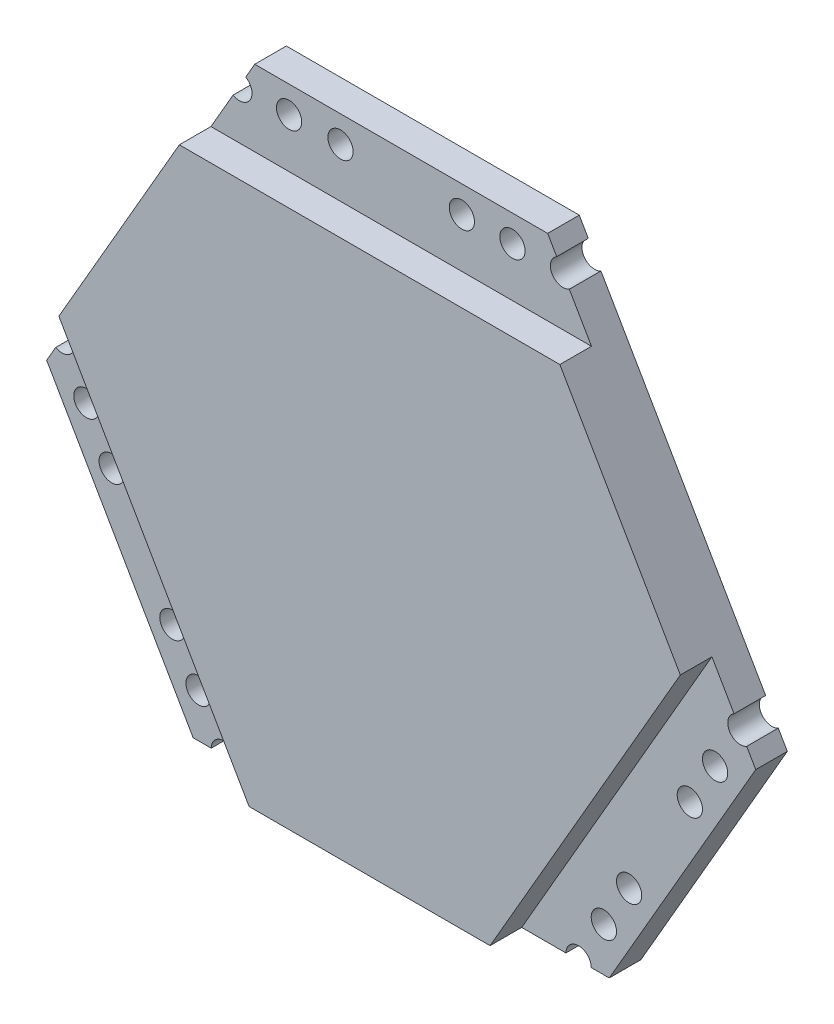
from build123d import *

# Parameters (mm, degrees)
EXTRUDE_4_DEPTH      = 10
SKETCH_4_W           = 60.2
SKETCH_4_H           = 12
CUT_EXTRUDE_2_DEPTH  = 5
CUT_EXTRUDE_9_DEPTH  = 125.764203881
CUT_EXTRUDE_12_DEPTH = 127.561979888
CUT_EXTRUDE_13_DEPTH = 124.620047186
CUT_EXTRUDE_15_DEPTH = 2


with BuildPart() as part:
    # 草圖1 → 填料-伸長4 (new body)
    with BuildSketch(Plane.XY):
        Polygon((49.802669845, 25.924393386), (-10.397330155, 25.924393386), (-29.457330155, -7.088495007), (0.642669845, -59.223224314), (38.762669845, -59.223224314), (68.862669845, -7.088495007), align=None)
        with BuildLine():
            Line((-0.037670798, 33.71862202), (-3.897330155, 33.71862202))
            ThreePointArc((-3.897330155, 33.71862202), (-4.897330155, 31.986571212), (-6.897330155, 31.986571212))
            Line((-6.897330155, 31.986571212), (-10.397330155, 25.924393386))
            Line((-10.397330155, 25.924393386), (49.802669845, 25.924393386))
            Line((49.802669845, 25.924393386), (46.302669845, 31.986571212))
            ThreePointArc((46.302669845, 31.986571212), (44.302669845, 31.986571212), (43.302669845, 33.71862202))
            Line((43.302669845, 33.71862202), (39.302669845, 33.71862202))
            ThreePointArc((39.302669845, 33.71862202), (37.302669845, 31.71862202), (35.302669845, 33.71862202))
            Line((35.302669845, 33.71862202), (31.302669845, 33.71862202))
            ThreePointArc((31.302669845, 33.71862202), (29.302669845, 31.71862202), (27.302669845, 33.71862202))
            Line((27.302669845, 33.71862202), (12.102669845, 33.71862202))
            ThreePointArc((12.102669845, 33.71862202), (10.102669845, 31.71862202), (8.102669845, 33.71862202))
            Line((8.102669845, 33.71862202), (3.962329202, 33.71862202))
            ThreePointArc((3.962329202, 33.71862202), (1.962329202, 31.71862202), (-0.037670798, 33.71862202))
        make_face()
        with BuildLine():
            ThreePointArc((-6.897330155, 31.986571212), (-6.897330155, 35.450672827), (-3.897330155, 33.71862202))
            Line((-3.897330155, 33.71862202), (-0.037670798, 33.71862202))
            ThreePointArc((-0.037670798, 33.71862202), (1.962329202, 35.71862202), (3.962329202, 33.71862202))
            Line((3.962329202, 33.71862202), (8.102669845, 33.71862202))
            ThreePointArc((8.102669845, 33.71862202), (10.102669845, 35.71862202), (12.102669845, 33.71862202))
            Line((12.102669845, 33.71862202), (27.302669845, 33.71862202))
            ThreePointArc((27.302669845, 33.71862202), (29.302669845, 35.71862202), (31.302669845, 33.71862202))
            Line((31.302669845, 33.71862202), (35.302669845, 33.71862202))
            ThreePointArc((35.302669845, 33.71862202), (37.302669845, 35.71862202), (39.302669845, 33.71862202))
            Line((39.302669845, 33.71862202), (43.302669845, 33.71862202))
            ThreePointArc((43.302669845, 33.71862202), (45.302669845, 35.71862202), (47.302669845, 33.71862202))
            ThreePointArc((47.302669845, 33.71862202), (47.034720652, 32.71862202), (46.302669845, 31.986571212))
            Line((46.302669845, 31.986571212), (49.802669845, 25.924393386))
            Line((49.802669845, 25.924393386), (49.802669845, 37.924393386))
            Line((49.802669845, 37.924393386), (-10.397330155, 37.924393386))
            Line((-10.397330155, 37.924393386), (-10.397330155, 25.924393386))
            Line((-10.397330155, 25.924393386), (-6.897330155, 31.986571212))
        make_face()
        with BuildLine():
            Line((-32.957330155, -13.150672833), (-29.457330155, -7.088495007))
            Line((-29.457330155, -7.088495007), (-39.849635001, -13.088495007))
            Line((-39.849635001, -13.088495007), (-9.749635001, -65.223224314))
            Line((-9.749635001, -65.223224314), (0.642669845, -59.223224314))
            Line((0.642669845, -59.223224314), (-6.357330155, -59.223224314))
            ThreePointArc((-6.357330155, -59.223224314), (-9.357330155, -60.955275122), (-9.357330155, -57.491173507))
            Line((-9.357330155, -57.491173507), (-11.357330155, -54.027071892))
            ThreePointArc((-11.357330155, -54.027071892), (-14.089380963, -53.295021084), (-13.357330155, -50.562970277))
            Line((-13.357330155, -50.562970277), (-15.394263476, -47.034898273))
            ThreePointArc((-15.394263476, -47.034898273), (-18.229721605, -46.366817854), (-17.390567155, -43.577198874))
            Line((-17.390567155, -43.577198874), (-24.994263476, -30.40721052))
            ThreePointArc((-24.994263476, -30.40721052), (-27.829721605, -29.739130101), (-26.990567155, -26.949511121))
            Line((-26.990567155, -26.949511121), (-28.994263476, -23.47900729))
            ThreePointArc((-28.994263476, -23.47900729), (-31.829721605, -22.810926871), (-30.990567155, -20.021307891))
            Line((-30.990567155, -20.021307891), (-32.957330155, -16.614774448))
            ThreePointArc((-32.957330155, -16.614774448), (-35.957330155, -14.882723641), (-32.957330155, -13.150672833))
        make_face()
        with BuildLine():
            Line((0.642669845, -59.223224314), (-29.457330155, -7.088495007))
            Line((-29.457330155, -7.088495007), (-32.957330155, -13.150672833))
            ThreePointArc((-32.957330155, -13.150672833), (-32.225279348, -13.882723641), (-31.957330155, -14.882723641))
            ThreePointArc((-31.957330155, -14.882723641), (-32.225279348, -15.882723641), (-32.957330155, -16.614774448))
            Line((-32.957330155, -16.614774448), (-30.990567155, -20.021307891))
            ThreePointArc((-30.990567155, -20.021307891), (-29.045480871, -20.110075214), (-28.097670798, -21.810926871))
            ThreePointArc((-28.097670798, -21.810926871), (-28.336021763, -22.75781265), (-28.994263476, -23.47900729))
            Line((-28.994263476, -23.47900729), (-26.990567155, -26.949511121))
            ThreePointArc((-26.990567155, -26.949511121), (-25.045480871, -27.038278445), (-24.097670798, -28.739130101))
            ThreePointArc((-24.097670798, -28.739130101), (-24.336021763, -29.68601588), (-24.994263476, -30.40721052))
            Line((-24.994263476, -30.40721052), (-17.390567155, -43.577198874))
            ThreePointArc((-17.390567155, -43.577198874), (-15.445480871, -43.665966197), (-14.497670798, -45.366817854))
            ThreePointArc((-14.497670798, -45.366817854), (-14.736021763, -46.313703633), (-15.394263476, -47.034898273))
            Line((-15.394263476, -47.034898273), (-13.357330155, -50.562970277))
            ThreePointArc((-13.357330155, -50.562970277), (-11.357330155, -50.562970277), (-10.357330155, -52.295021084))
            ThreePointArc((-10.357330155, -52.295021084), (-10.625279348, -53.295021084), (-11.357330155, -54.027071892))
            Line((-11.357330155, -54.027071892), (-9.357330155, -57.491173507))
            ThreePointArc((-9.357330155, -57.491173507), (-7.357330155, -57.491173507), (-6.357330155, -59.223224314))
            Line((-6.357330155, -59.223224314), (0.642669845, -59.223224314))
        make_face()
        with BuildLine():
            Line((79.25497469, -13.088495007), (68.862669845, -7.088495007))
            Line((68.862669845, -7.088495007), (72.362669845, -13.150672833))
            ThreePointArc((72.362669845, -13.150672833), (74.362669845, -13.150672833), (75.362669845, -14.882723641))
            ThreePointArc((75.362669845, -14.882723641), (74.362669845, -16.614774448), (72.362669845, -16.614774448))
            Line((72.362669845, -16.614774448), (70.362669845, -20.078876063))
            ThreePointArc((70.362669845, -20.078876063), (71.094720652, -20.810926871), (71.362669845, -21.810926871))
            ThreePointArc((71.362669845, -21.810926871), (70.362669845, -23.542977679), (68.362669845, -23.542977679))
            Line((68.362669845, -23.542977679), (66.362669845, -27.007079294))
            ThreePointArc((66.362669845, -27.007079294), (67.094720652, -27.739130101), (67.362669845, -28.739130101))
            ThreePointArc((67.362669845, -28.739130101), (66.362669845, -30.471180909), (64.362669845, -30.471180909))
            Line((64.362669845, -30.471180909), (56.762669845, -43.634767046))
            ThreePointArc((56.762669845, -43.634767046), (57.494720652, -44.366817854), (57.762669845, -45.366817854))
            ThreePointArc((57.762669845, -45.366817854), (56.762669845, -47.098868661), (54.762669845, -47.098868661))
            Line((54.762669845, -47.098868661), (52.762669845, -50.562970277))
            ThreePointArc((52.762669845, -50.562970277), (53.494720652, -51.295021084), (53.762669845, -52.295021084))
            ThreePointArc((53.762669845, -52.295021084), (52.762669845, -54.027071892), (50.762669845, -54.027071892))
            Line((50.762669845, -54.027071892), (48.762669845, -57.491173507))
            ThreePointArc((48.762669845, -57.491173507), (49.494720652, -58.223224314), (49.762669845, -59.223224314))
            ThreePointArc((49.762669845, -59.223224314), (47.762669845, -61.223224314), (45.762669845, -59.223224314))
            Line((45.762669845, -59.223224314), (38.762669845, -59.223224314))
            Line((38.762669845, -59.223224314), (49.15497469, -65.223224314))
            Line((49.15497469, -65.223224314), (79.25497469, -13.088495007))
        make_face()
        with BuildLine():
            Line((72.362669845, -13.150672833), (68.862669845, -7.088495007))
            Line((68.862669845, -7.088495007), (38.762669845, -59.223224314))
            Line((38.762669845, -59.223224314), (45.762669845, -59.223224314))
            ThreePointArc((45.762669845, -59.223224314), (46.762669845, -57.491173507), (48.762669845, -57.491173507))
            Line((48.762669845, -57.491173507), (50.762669845, -54.027071892))
            ThreePointArc((50.762669845, -54.027071892), (50.030619037, -51.295021084), (52.762669845, -50.562970277))
            Line((52.762669845, -50.562970277), (54.762669845, -47.098868661))
            ThreePointArc((54.762669845, -47.098868661), (54.030619037, -44.366817854), (56.762669845, -43.634767046))
            Line((56.762669845, -43.634767046), (64.362669845, -30.471180909))
            ThreePointArc((64.362669845, -30.471180909), (63.630619037, -27.739130101), (66.362669845, -27.007079294))
            Line((66.362669845, -27.007079294), (68.362669845, -23.542977679))
            ThreePointArc((68.362669845, -23.542977679), (67.630619037, -20.810926871), (70.362669845, -20.078876063))
            Line((70.362669845, -20.078876063), (72.362669845, -16.614774448))
            ThreePointArc((72.362669845, -16.614774448), (71.362669845, -14.882723641), (72.362669845, -13.150672833))
        make_face()
    extrude(amount=EXTRUDE_4_DEPTH)

    # 草圖4 → 除料-伸長2 (cut)
    with BuildSketch(Plane.XY.offset(10)):
        Polygon((38.762669845, -59.223224314), (49.15497469, -65.223224314), (79.264488572, -13.07201648), (68.872183727, -7.07201648), align=None)
        with Locations((19.702669845, 31.924393386)):
            Rectangle(SKETCH_4_W, SKETCH_4_H)
        Polygon((-29.457330155, -7.088495007), (-39.849635001, -13.088495007), (-9.472158735, -65.703827304), (0.92014611, -59.703827304), align=None)
    extrude(amount=-CUT_EXTRUDE_2_DEPTH, mode=Mode.SUBTRACT)

    # 草圖7 → 除料-伸長9 (cut, through all)
    with BuildSketch(Plane(origin=(-19.023589241, 10.983274369, 0), x_dir=(0, 0, 1), z_dir=(-0.8660254037844397, 0.499999999999998, 0))):
        Polygon((5, -20.867481828), (0, -20.867481828), (0, -53.816238545), (10, -53.816238545), (10, -20.867481828), align=None)
        Polygon((0, 46.26799966), (0, 17.252518172), (5, 17.252518172), (10, 17.252518172), (10, 46.26799966), align=None)
    extrude(amount=CUT_EXTRUDE_9_DEPTH, mode=Mode.SUBTRACT)

    # 草圖12 → 除料-伸長12 (cut, through all)
    with BuildSketch(Plane(origin=(48.577594008, 28.046286977, 0), x_dir=(0, 0, -1), z_dir=(0.8660254037844363, 0.5000000000000042, 0))):
        Polygon((0, -70.38008838), (0, -40.570151673), (-5, -40.570151673), (-10, -40.570151673), (-10, -70.38008838), align=None)
        Polygon((-5, -2.450151673), (0, -2.450151673), (0, 27.877960609), (-10, 27.877960609), (-10, -2.450151673), align=None)
    extrude(amount=CUT_EXTRUDE_12_DEPTH, mode=Mode.SUBTRACT)

    # 草圖13 → 除料-伸長13 (cut, through all)
    with BuildSketch(Plane.XZ.offset(59.223224314)):
        Polygon((66.260162627, 10), (38.762669845, 10), (38.762669845, 5), (38.762669845, 0), (66.260162627, 0), align=None)
        Polygon((0.642669845, 5), (0.642669845, 10), (-25.338575987, 10), (-25.338575987, 0), (0.642669845, 0), align=None)
    extrude(amount=CUT_EXTRUDE_13_DEPTH, mode=Mode.SUBTRACT)

    # 草圖17 → 除料-伸長15 (cut)
    # profile 1 of 6: a face of its own
    with BuildSketch(Plane(origin=(0, 0, 0), x_dir=(-1, 0, 0), z_dir=(0, 0, -1))):
        with BuildLine():
            Line((-28.264869636, -8.814389023), (-26.341517093, -8.814389023))
            add(Edge.make_bspline(
                [(-26.341517093, -8.814389023), (-26.267762258, -8.815115902), (-26.125122028, -8.81652167), (-25.917994809, -8.821198537), (-25.724588531, -8.831498349), (-25.545173867, -8.848220675), (-25.379122319, -8.865738903), (-25.227129952, -8.890048986), (-25.088726858, -8.917588419), (-24.962442322, -8.949442158), (-24.846181362, -8.988723142), (-24.736434733, -9.034877236), (-24.633052769, -9.09146439), (-24.535793645, -9.157147599), (-24.44309089, -9.23066092), (-24.356661164, -9.313299245), (-24.276156697, -9.404856412), (-24.200765488, -9.505399171), (-24.131548469, -9.618323397), (-24.073246605, -9.747418162), (-24.024668758, -9.892341629), (-23.982810629, -10.052463218), (-23.953582049, -10.228812497), (-23.931027342, -10.420501005), (-23.915691302, -10.628199446), (-23.914797229, -10.772367713), (-23.914334154, -10.847038106)],
                knots=[0, 0, 0, 0, 1.41969272, 2.745654521, 3.987543411, 5.14658096, 6.21373459, 7.200711201, 8.108042895, 8.929411192, 9.70554979, 10.467999137, 11.218070552, 11.969943563, 12.724535131, 13.49271798, 14.268243868, 15.068689038, 15.909069341, 16.81215954, 17.78844528, 18.848344307, 19.994182421, 21.225693104, 22.563077773, 24, 24, 24, 24], degree=3))
            add(Edge.make_bspline(
                [(-23.914334154, -10.847038106), (-23.914545592, -10.897268376), (-23.914952171, -10.993857585), (-23.926359188, -11.132606), (-23.942081658, -11.259389383), (-23.962464159, -11.375166198), (-23.99183029, -11.478452761), (-24.026413023, -11.570667737), (-24.0673573, -11.65118762), (-24.116534517, -11.721401469), (-24.175850425, -11.782838537), (-24.246487256, -11.839097947), (-24.328513003, -11.89209201), (-24.423970742, -11.939643172), (-24.529946257, -11.987246124), (-24.650266399, -12.026701299), (-24.781418342, -12.06661713), (-24.873852581, -12.087658071), (-24.921994946, -12.098616788)],
                knots=[0, 0, 0, 0, 1.327920484, 2.553495959, 3.678584238, 4.706394844, 5.65862556, 6.514014339, 7.30753027, 8.04101456, 8.772331145, 9.55771541, 10.424646689, 11.349518022, 12.375513716, 13.493956262, 14.694781581, 16, 16, 16, 16], degree=3))
            add(Edge.make_bspline(
                [(-24.921994946, -12.098616788), (-24.87070196, -12.111229348), (-24.771641552, -12.135587558), (-24.630933388, -12.182628868), (-24.503128838, -12.235715251), (-24.387482117, -12.293945116), (-24.285245803, -12.359726309), (-24.195785759, -12.431551488), (-24.118375022, -12.50916541), (-24.054998232, -12.595151954), (-24.000825085, -12.689169527), (-23.95400598, -12.793541234), (-23.916196822, -12.90998304), (-23.883985732, -13.03775057), (-23.859030899, -13.17669102), (-23.842129631, -13.327642225), (-23.83143877, -13.48955044), (-23.829848941, -13.6016488), (-23.829029537, -13.659424708)],
                knots=[0, 0, 0, 0, 1.193541528, 2.305046348, 3.349469872, 4.319601517, 5.227715379, 6.091898615, 6.908561027, 7.697906746, 8.498857849, 9.357421084, 10.27838222, 11.262396817, 12.333987418, 13.466302598, 14.694123014, 16, 16, 16, 16], degree=3))
            Line((-23.829029537, -13.659424708), (-23.829029537, -14.340528761))
            add(Edge.make_bspline(
                [(-23.829029537, -14.340528761), (-23.829505112, -14.400518082), (-23.830425013, -14.51655473), (-23.838478833, -14.684611184), (-23.851525572, -14.840705903), (-23.86996245, -14.984848735), (-23.893688343, -15.117061175), (-23.922765716, -15.237339911), (-23.957102227, -15.345782049), (-24.009390324, -15.471867389), (-24.089879669, -15.610982556), (-24.215684315, -15.750115201), (-24.366155705, -15.861445774), (-24.514101564, -15.92923552), (-24.65254922, -15.968458762), (-24.782211478, -15.994784395), (-24.935730119, -16.016942256), (-25.114202653, -16.033208005), (-25.315917824, -16.047983273), (-25.542569572, -16.058779324), (-25.793240946, -16.063115231), (-25.968753201, -16.064539021), (-26.060278433, -16.065281492)],
                knots=[0, 0, 0, 0, 1.057231904, 2.044991421, 2.964498811, 3.817267374, 4.605195048, 5.330688826, 5.996832831, 6.607610909, 7.734358025, 8.809960447, 9.890596186, 11.011751471, 11.656044114, 12.423911222, 13.341950389, 14.388368498, 15.581715371, 16.906549738, 18.386843414, 20, 20, 20, 20], degree=3))
            Line((-26.060278433, -16.065281492), (-28.264869636, -16.065281492))
            Line((-28.264869636, -16.065281492), (-28.264869636, -8.814389023))
        make_face()
        with BuildLine():
            Line((-26.388168055, -10.008653665), (-26.388168055, -11.629441393))
            add(Edge.make_bspline(
                [(-26.388168055, -11.629441393), (-26.348627402, -11.628467699), (-26.279324388, -11.626761104), (-26.210006709, -11.625838817), (-26.180238051, -11.625442739)],
                knots=[0, 0, 0, 0, 1.141094767, 2, 2, 2, 2], degree=3))
            add(Edge.make_bspline(
                [(-26.180238051, -11.625442739), (-26.13339575, -11.624601426), (-26.048527942, -11.623077154), (-25.934771281, -11.596358512), (-25.846030816, -11.555163468), (-25.792635238, -11.499907409), (-25.766930352, -11.441478395), (-25.750106372, -11.382794381), (-25.737820926, -11.3080112), (-25.725640796, -11.217839383), (-25.716796995, -11.11106724), (-25.710343018, -10.988836379), (-25.706373156, -10.850617975), (-25.705953409, -10.753294588), (-25.705731117, -10.70175368)],
                knots=[0, 0, 0, 0, 1.37184632, 2.485479705, 3.407178563, 4.210095408, 4.671083265, 5.269542147, 5.998719677, 6.893441603, 7.940942625, 9.142754617, 10.486848569, 12, 12, 12, 12], degree=3))
            add(Edge.make_bspline(
                [(-25.705731117, -10.70175368), (-25.706198799, -10.64883793), (-25.707061326, -10.551247575), (-25.720353628, -10.418015675), (-25.73960551, -10.309521989), (-25.770856552, -10.22507981), (-25.809226319, -10.16018185), (-25.852546404, -10.10960011), (-25.900954065, -10.070757882), (-25.959328104, -10.045363778), (-26.032540593, -10.030012715), (-26.127520941, -10.018871401), (-26.248997502, -10.011321367), (-26.338839535, -10.009599223), (-26.388168055, -10.008653665)],
                knots=[0, 0, 0, 0, 1.612962093, 2.974720053, 4.080187332, 4.963539136, 5.704836737, 6.3676796, 6.985654596, 7.580003915, 8.289925548, 9.259673838, 10.495400982, 12, 12, 12, 12], degree=3))
        make_face(mode=Mode.SUBTRACT)
        with BuildLine():
            Line((-26.388168055, -12.738401418), (-26.388168055, -14.87101685))
            add(Edge.make_bspline(
                [(-26.388168055, -14.87101685), (-26.35305961, -14.869447307), (-26.28632605, -14.866463945), (-26.191048904, -14.858980228), (-26.106164604, -14.846780723), (-26.030668981, -14.832791901), (-25.965259964, -14.813971145), (-25.909244516, -14.793165974), (-25.862715198, -14.769673145), (-25.825758674, -14.740281269), (-25.796642501, -14.703032502), (-25.771038564, -14.65751132), (-25.751977124, -14.599851142), (-25.734810026, -14.532653675), (-25.721639155, -14.454624646), (-25.713051255, -14.365993418), (-25.705627469, -14.266895385), (-25.70569558, -14.197038003), (-25.705731117, -14.160589334)],
                knots=[0, 0, 0, 0, 1.419095288, 2.697393149, 3.856866357, 4.880718774, 5.794967692, 6.601281627, 7.291456808, 7.891047755, 8.490638702, 9.189387817, 9.989490768, 10.933700266, 11.989587216, 13.180284702, 14.528790147, 16, 16, 16, 16], degree=3))
            Line((-25.705731117, -14.160589334), (-25.705731117, -13.448828934))
            add(Edge.make_bspline(
                [(-25.705731117, -13.448828934), (-25.70589286, -13.410174498), (-25.706199794, -13.336821112), (-25.710970428, -13.232667429), (-25.721522564, -13.14044912), (-25.729773612, -13.059711845), (-25.747012676, -12.991914807), (-25.764397444, -12.935368222), (-25.787013738, -12.890838403), (-25.813350404, -12.855669945), (-25.849250442, -12.830476588), (-25.892970299, -12.807968397), (-25.948919789, -12.789906803), (-26.015373432, -12.774304516), (-26.092865593, -12.761232827), (-26.181382347, -12.75072845), (-26.280987773, -12.742870511), (-26.351278671, -12.739939593), (-26.388168055, -12.738401418)],
                knots=[0, 0, 0, 0, 1.538310229, 2.919206019, 4.145426389, 5.233175983, 6.142307499, 6.925059207, 7.5813867, 8.122596664, 8.653013429, 9.309340922, 10.075339784, 10.9844713, 12.025073956, 13.200531974, 14.530810454, 16, 16, 16, 16], degree=3))
        make_face(mode=Mode.SUBTRACT)
    # profile 2 of 6: a face of its own
    with BuildSketch(Plane(origin=(0, 0, 0), x_dir=(-1, 0, 0), z_dir=(0, 0, -1))):
        with BuildLine():
            Line((-19.051970968, -10.093958282), (-19.051970968, -16.065281492))
            Line((-19.051970968, -16.065281492), (-20.872691394, -16.065281492))
            Line((-20.872691394, -16.065281492), (-20.843367932, -15.554786673))
            add(Edge.make_bspline(
                [(-20.843367932, -15.554786673), (-20.874561057, -15.602372526), (-20.935288618, -15.695013863), (-21.045492849, -15.815791893), (-21.164252292, -15.919778896), (-21.294628914, -16.004124678), (-21.4348255, -16.070446461), (-21.585599233, -16.116909205), (-21.746421104, -16.145530556), (-21.857127576, -16.148876875), (-21.913674302, -16.150586109)],
                knots=[0, 0, 0, 0, 1.061666706, 2.066879479, 3.043894156, 4.004116477, 4.958543322, 5.932696836, 6.944061519, 8, 8, 8, 8], degree=3))
            add(Edge.make_bspline(
                [(-21.913674302, -16.150586109), (-21.977320315, -16.148883933), (-22.099437057, -16.14561799), (-22.274236592, -16.118411095), (-22.433154809, -16.075805994), (-22.573790928, -16.012107986), (-22.698074444, -15.935393045), (-22.801887793, -15.842448198), (-22.89428073, -15.743015815), (-22.963237712, -15.628102373), (-23.019241662, -15.507903276), (-23.062359129, -15.384278164), (-23.096874725, -15.258950394), (-23.115047393, -15.15008024), (-23.123138033, -15.053220645), (-23.13003851, -14.964841798), (-23.135179206, -14.860392925), (-23.138686045, -14.740397451), (-23.143129752, -14.604463561), (-23.145526106, -14.452499122), (-23.146901146, -14.284550315), (-23.146698517, -14.167254082), (-23.146592598, -14.105941064)],
                knots=[0, 0, 0, 0, 1.372356562, 2.633121929, 3.807600132, 4.910298633, 5.952776581, 6.944670893, 7.908661259, 8.868831557, 9.820833315, 10.766735229, 11.689826756, 12.622720248, 13.142547126, 13.786556214, 14.535201573, 15.398368654, 16.376504451, 17.469410664, 18.677211821, 20, 20, 20, 20], degree=3))
            Line((-23.146592598, -14.105941064), (-23.146592598, -10.093958282))
            Line((-23.146592598, -10.093958282), (-21.355195635, -10.093958282))
            Line((-21.355195635, -10.093958282), (-21.355195635, -14.165920873))
            add(Edge.make_bspline(
                [(-21.355195635, -14.165920873), (-21.355483268, -14.22146045), (-21.356026359, -14.326327178), (-21.352441081, -14.474704868), (-21.350430116, -14.604910953), (-21.346437004, -14.717334448), (-21.34134959, -14.8120173), (-21.334912995, -14.88937449), (-21.327560195, -14.949151643), (-21.316329142, -15.003533174), (-21.292973204, -15.055582882), (-21.242936007, -15.097903731), (-21.177569732, -15.123847815), (-21.128436747, -15.125850818), (-21.101947553, -15.126930702)],
                knots=[0, 0, 0, 0, 1.812042913, 3.421398194, 4.842335651, 6.06080483, 7.091677302, 7.935583642, 8.593692084, 9.054393081, 9.748100288, 10.405409957, 11.140304508, 12, 12, 12, 12], degree=3))
            add(Edge.make_bspline(
                [(-21.101947553, -15.126930702), (-21.073729485, -15.125863408), (-21.022077881, -15.123909786), (-20.952503397, -15.098511419), (-20.901904685, -15.053403595), (-20.87870582, -14.99908477), (-20.870544772, -14.94267611), (-20.861531386, -14.880612152), (-20.857963766, -14.799470556), (-20.85188875, -14.700027787), (-20.848211071, -14.581798625), (-20.846092348, -14.444939768), (-20.842550844, -14.289004779), (-20.843085521, -14.178807716), (-20.843367932, -14.120602795)],
                knots=[0, 0, 0, 0, 0.876067957, 1.603593713, 2.260088472, 2.929160625, 3.393475713, 4.035657034, 4.88190587, 5.921621531, 7.140530935, 8.566649448, 10.186540624, 12, 12, 12, 12], degree=3))
            Line((-20.843367932, -14.120602795), (-20.843367932, -10.093958282))
            Line((-20.843367932, -10.093958282), (-19.051970968, -10.093958282))
        make_face()
    # profile 3 of 6: a face of its own
    with BuildSketch(Plane(origin=(0, 0, 0), x_dir=(-1, 0, 0), z_dir=(0, 0, -1))):
        with BuildLine():
            Line((-16.578137067, -9.326216726), (-16.578137067, -10.264567517))
            Line((-16.578137067, -10.264567517), (-15.981004746, -10.264567517))
            Line((-15.981004746, -10.264567517), (-15.981004746, -11.202918307))
            Line((-15.981004746, -11.202918307), (-16.578137067, -11.202918307))
            Line((-16.578137067, -11.202918307), (-16.578137067, -14.401841455))
            add(Edge.make_bspline(
                [(-16.578137067, -14.401841455), (-16.57772504, -14.448490612), (-16.576951928, -14.53602112), (-16.575384829, -14.659188405), (-16.568259875, -14.765828326), (-16.560138016, -14.856438872), (-16.552574558, -14.931194326), (-16.538680883, -14.988997266), (-16.525528834, -15.031426237), (-16.506818618, -15.062029103), (-16.476105822, -15.079180256), (-16.435392999, -15.091628799), (-16.380217783, -15.101498207), (-16.311280427, -15.110504809), (-16.227735193, -15.118722324), (-16.129897624, -15.123604649), (-16.017448194, -15.125910124), (-15.937909099, -15.126576877), (-15.895700129, -15.126930702)],
                knots=[0, 0, 0, 0, 1.739732428, 3.26436042, 4.592396978, 5.723406921, 6.6584426, 7.389883741, 7.934871935, 8.316298907, 8.688621296, 9.212551535, 9.90465525, 10.773969042, 11.805991926, 13.033823307, 14.425940557, 16, 16, 16, 16], degree=3))
            Line((-15.895700129, -15.126930702), (-15.895700129, -16.065281492))
            Line((-15.895700129, -16.065281492), (-16.655444377, -16.065281492))
            add(Edge.make_bspline(
                [(-16.655444377, -16.065281492), (-16.706982165, -16.064789789), (-16.806503684, -16.063840292), (-16.950035343, -16.063235804), (-17.082046928, -16.059497213), (-17.20238044, -16.052064623), (-17.311290148, -16.045894772), (-17.409174104, -16.038397564), (-17.495342245, -16.02750067), (-17.594455667, -16.012460518), (-17.707106433, -15.98284398), (-17.833793738, -15.932713397), (-17.950667662, -15.862745442), (-18.059436122, -15.780495244), (-18.15261321, -15.68422412), (-18.229378554, -15.580124337), (-18.285655158, -15.468898738), (-18.317651724, -15.367524841), (-18.332167556, -15.274225456), (-18.343148186, -15.184039713), (-18.35028694, -15.073230571), (-18.356461587, -14.942120176), (-18.363836416, -14.791108395), (-18.367513585, -14.620008195), (-18.368103396, -14.428498571), (-18.36904167, -14.293877505), (-18.36953403, -14.223234913)],
                knots=[0, 0, 0, 0, 1.195583195, 2.308718731, 3.329517598, 4.258521121, 5.105212991, 5.860114927, 6.535083728, 7.11964657, 8.184549345, 9.22951552, 10.268875888, 11.334626177, 12.384156653, 13.365429045, 14.324142953, 15.262984696, 15.817041888, 16.512473617, 17.370134424, 18.391765408, 19.557524602, 20.877102082, 22.361254963, 24, 24, 24, 24], degree=3))
            Line((-18.36953403, -14.223234913), (-18.36953403, -11.202918307))
            Line((-18.36953403, -11.202918307), (-18.710752499, -11.202918307))
            Line((-18.710752499, -11.202918307), (-18.710752499, -10.264567517))
            Line((-18.710752499, -10.264567517), (-18.36953403, -10.264567517))
            Line((-18.36953403, -10.264567517), (-18.36953403, -9.326216726))
            Line((-18.36953403, -9.326216726), (-16.578137067, -9.326216726))
        make_face()
    # profile 4 of 6: a face of its own
    with BuildSketch(Plane(origin=(0, 0, 0), x_dir=(-1, 0, 0), z_dir=(0, 0, -1))):
        with BuildLine():
            Line((-13.763084697, -9.326216726), (-13.763084697, -10.264567517))
            Line((-13.763084697, -10.264567517), (-13.165952376, -10.264567517))
            Line((-13.165952376, -10.264567517), (-13.165952376, -11.202918307))
            Line((-13.165952376, -11.202918307), (-13.763084697, -11.202918307))
            Line((-13.763084697, -11.202918307), (-13.763084697, -14.401841455))
            add(Edge.make_bspline(
                [(-13.763084697, -14.401841455), (-13.762672669, -14.448490612), (-13.761899558, -14.53602112), (-13.760332458, -14.659188405), (-13.753207504, -14.765828326), (-13.745085645, -14.856438872), (-13.737522187, -14.931194326), (-13.723628513, -14.988997266), (-13.710476463, -15.031426237), (-13.691766247, -15.062029103), (-13.661053451, -15.079180256), (-13.620340628, -15.091628799), (-13.565165413, -15.101498207), (-13.496228056, -15.110504809), (-13.412682823, -15.118722324), (-13.314845254, -15.123604649), (-13.202395823, -15.125910124), (-13.122856728, -15.126576877), (-13.080647758, -15.126930702)],
                knots=[0, 0, 0, 0, 1.739732428, 3.26436042, 4.592396978, 5.723406921, 6.6584426, 7.389883741, 7.934871935, 8.316298907, 8.688621296, 9.212551535, 9.90465525, 10.773969042, 11.805991926, 13.033823307, 14.425940557, 16, 16, 16, 16], degree=3))
            Line((-13.080647758, -15.126930702), (-13.080647758, -16.065281492))
            Line((-13.080647758, -16.065281492), (-13.840392006, -16.065281492))
            add(Edge.make_bspline(
                [(-13.840392006, -16.065281492), (-13.891929794, -16.064789789), (-13.991451314, -16.063840292), (-14.134982972, -16.063235804), (-14.266994557, -16.059497213), (-14.387328069, -16.052064623), (-14.496237778, -16.045894772), (-14.594121734, -16.038397564), (-14.680289874, -16.02750067), (-14.779403296, -16.012460518), (-14.892054063, -15.98284398), (-15.018741367, -15.932713397), (-15.135615292, -15.862745442), (-15.244383752, -15.780495244), (-15.33756084, -15.68422412), (-15.414326183, -15.580124337), (-15.470602788, -15.468898738), (-15.502599354, -15.367524841), (-15.517115185, -15.274225456), (-15.528095816, -15.184039713), (-15.535234569, -15.073230571), (-15.541409216, -14.942120176), (-15.548784045, -14.791108395), (-15.552461214, -14.620008195), (-15.553051026, -14.428498571), (-15.553989299, -14.293877505), (-15.55448166, -14.223234913)],
                knots=[0, 0, 0, 0, 1.195583195, 2.308718731, 3.329517598, 4.258521121, 5.105212991, 5.860114927, 6.535083728, 7.11964657, 8.184549345, 9.22951552, 10.268875888, 11.334626177, 12.384156653, 13.365429045, 14.324142953, 15.262984696, 15.817041888, 16.512473617, 17.370134424, 18.391765408, 19.557524602, 20.877102082, 22.361254963, 24, 24, 24, 24], degree=3))
            Line((-15.55448166, -14.223234913), (-15.55448166, -11.202918307))
            Line((-15.55448166, -11.202918307), (-15.895700129, -11.202918307))
            Line((-15.895700129, -11.202918307), (-15.895700129, -10.264567517))
            Line((-15.895700129, -10.264567517), (-15.55448166, -10.264567517))
            Line((-15.55448166, -10.264567517), (-15.55448166, -9.326216726))
            Line((-15.55448166, -9.326216726), (-13.763084697, -9.326216726))
        make_face()
    # profile 5 of 6: a face of its own
    with BuildSketch(Plane(origin=(0, 0, 0), x_dir=(-1, 0, 0), z_dir=(0, 0, -1))):
        with BuildLine():
            Line((-8.730112276, -12.197250252), (-8.730112276, -13.648761631))
            add(Edge.make_bspline(
                [(-8.730112276, -13.648761631), (-8.730293448, -13.713188861), (-8.730643333, -13.837613448), (-8.735408429, -14.017533459), (-8.739384751, -14.184265863), (-8.749874469, -14.337460127), (-8.759104903, -14.477656473), (-8.774656527, -14.604153847), (-8.789877113, -14.717679785), (-8.8145127, -14.851113074), (-8.857076418, -15.007230152), (-8.93079345, -15.186246787), (-9.030043318, -15.35718225), (-9.147364952, -15.522144975), (-9.28584171, -15.674166276), (-9.446854574, -15.803858122), (-9.624368386, -15.914953122), (-9.821272691, -16.00215827), (-10.034924377, -16.06840171), (-10.26347664, -16.1157131), (-10.506927345, -16.145971569), (-10.674253892, -16.149021458), (-10.760095591, -16.150586109)],
                knots=[0, 0, 0, 0, 1.030820639, 1.990764312, 2.879836517, 3.698877591, 4.447479564, 5.127340947, 5.737592725, 6.27997261, 7.297519797, 8.320663796, 9.368189507, 10.453252059, 11.55504584, 12.646447391, 13.751149947, 14.896660089, 16.081551939, 17.323827552, 18.627072679, 20, 20, 20, 20], degree=3))
            add(Edge.make_bspline(
                [(-10.760095591, -16.150586109), (-10.855239288, -16.149324595), (-11.03789803, -16.146902715), (-11.300698837, -16.120977312), (-11.541008677, -16.080458828), (-11.759500225, -16.024475844), (-11.954567983, -15.949025166), (-12.128311369, -15.859475932), (-12.278057512, -15.750284414), (-12.405385801, -15.624646881), (-12.510995702, -15.482372351), (-12.600611168, -15.327013188), (-12.673829186, -15.157875229), (-12.722151825, -15.006429513), (-12.751521481, -14.874151774), (-12.771848188, -14.76218727), (-12.786646389, -14.637874899), (-12.80205214, -14.50250067), (-12.812561877, -14.354874863), (-12.818124348, -14.19570913), (-12.824556131, -14.024682675), (-12.82467333, -13.906904224), (-12.824733906, -13.846028558)],
                knots=[0, 0, 0, 0, 1.566851768, 3.008072865, 4.344862402, 5.578649608, 6.716279408, 7.783554075, 8.789251884, 9.757031178, 10.718730646, 11.699157592, 12.705361265, 13.749293612, 14.312132592, 14.936642054, 15.622938965, 16.373791341, 17.180992382, 18.06001777, 18.997289313, 20, 20, 20, 20], degree=3))
            Line((-12.824733906, -13.846028558), (-12.824733906, -12.326540063))
            add(Edge.make_bspline(
                [(-12.824733906, -12.326540063), (-12.82420518, -12.259447333), (-12.823178842, -12.129210019), (-12.815747971, -11.939307725), (-12.800250974, -11.761196441), (-12.782892895, -11.593744521), (-12.756725074, -11.438363315), (-12.728476175, -11.293366858), (-12.69224957, -11.160420253), (-12.651174878, -11.037020834), (-12.600878292, -10.922845532), (-12.544280366, -10.814157731), (-12.476088261, -10.712790023), (-12.402806716, -10.614842148), (-12.31685791, -10.525333475), (-12.224355894, -10.440023924), (-12.121965922, -10.361098527), (-12.0118866, -10.287831689), (-11.892497471, -10.222056484), (-11.764638653, -10.165604853), (-11.629817111, -10.115179498), (-11.485811474, -10.077286035), (-11.334440493, -10.04691774), (-11.174756894, -10.023951942), (-11.007355895, -10.01060764), (-10.892963723, -10.009312766), (-10.834737131, -10.008653665)],
                knots=[0, 0, 0, 0, 1.367165939, 2.653879496, 3.871100312, 5.009836591, 6.082946868, 7.080781523, 8.018528806, 8.888869268, 9.728143456, 10.558384481, 11.381984661, 12.214936081, 13.047543032, 13.906222177, 14.777268644, 15.678695825, 16.598484629, 17.550802427, 18.52460938, 19.528259021, 20.581129208, 21.669407874, 22.813708716, 24, 24, 24, 24], degree=3))
            add(Edge.make_bspline(
                [(-10.834737131, -10.008653665), (-10.737746241, -10.01023407), (-10.550643568, -10.01328279), (-10.280944416, -10.04973566), (-10.031669128, -10.103185937), (-9.805676164, -10.184881727), (-9.601871261, -10.281121964), (-9.421616532, -10.39235512), (-9.264528557, -10.516058261), (-9.135430656, -10.656318185), (-9.028438456, -10.803151061), (-8.937293472, -10.951892375), (-8.866830864, -11.104126953), (-8.821826299, -11.235063439), (-8.795336603, -11.345498509), (-8.778695949, -11.437744134), (-8.761821998, -11.539301529), (-8.750696102, -11.651519226), (-8.741336181, -11.773729699), (-8.734829221, -11.906179835), (-8.730817559, -12.048386065), (-8.730352256, -12.146597726), (-8.730112276, -12.197250252)],
                knots=[0, 0, 0, 0, 1.658815711, 3.199979415, 4.649957207, 6.01364259, 7.3027161, 8.501301308, 9.631864061, 10.713282271, 11.752046223, 12.737947139, 13.693922422, 14.617315316, 15.102372854, 15.636288777, 16.22136206, 16.863764619, 17.565366476, 18.319134645, 19.133096068, 20, 20, 20, 20], degree=3))
        make_face()
        with BuildLine():
            add(Edge.make_bspline(
                [(-10.52150924, -11.733406395), (-10.522014964, -11.696531716), (-10.522971584, -11.6267802), (-10.523395758, -11.527207208), (-10.52770394, -11.438787477), (-10.532878482, -11.360549507), (-10.539416221, -11.293433296), (-10.546723368, -11.236244938), (-10.557614542, -11.190627467), (-10.570485297, -11.144079084), (-10.597468963, -11.098952683), (-10.643020663, -11.057202546), (-10.705369488, -11.03698871), (-10.749775909, -11.033935207), (-10.773424437, -11.032309072)],
                knots=[0, 0, 0, 0, 1.585193112, 2.998524278, 4.279327145, 5.389603052, 6.36823621, 7.178467141, 7.864111684, 8.383615122, 9.248283339, 10.08726259, 10.981376477, 12, 12, 12, 12], degree=3))
            add(Edge.make_bspline(
                [(-10.773424437, -11.032309072), (-10.797593624, -11.033761939), (-10.842172194, -11.036441663), (-10.904340525, -11.058330122), (-10.952104137, -11.098202243), (-10.979725038, -11.144182588), (-10.995114716, -11.190316776), (-11.004882367, -11.23643203), (-11.014833639, -11.293246491), (-11.020003233, -11.360653317), (-11.027785227, -11.438696436), (-11.031248065, -11.527225009), (-11.031934748, -11.626774909), (-11.03285202, -11.696529886), (-11.033336943, -11.733406395)],
                knots=[0, 0, 0, 0, 1.033270833, 1.905804199, 2.770216926, 3.641090693, 4.164334303, 4.847116915, 5.656874259, 6.631422529, 7.738535089, 9.013991789, 10.421423604, 12, 12, 12, 12], degree=3))
            Line((-11.033336943, -11.733406395), (-11.033336943, -14.443160879))
            add(Edge.make_bspline(
                [(-11.033336943, -14.443160879), (-11.033266638, -14.508052696), (-11.033139384, -14.625506788), (-11.022132453, -14.783425545), (-11.008272441, -14.904569938), (-10.987074667, -14.993417814), (-10.953161958, -15.056223827), (-10.905359146, -15.09810338), (-10.844938138, -15.123211032), (-10.800780316, -15.125643861), (-10.777423091, -15.126930702)],
                knots=[0, 0, 0, 0, 1.905444241, 3.448851208, 4.646660283, 5.485608871, 6.116872217, 6.708589425, 7.316910003, 8, 8, 8, 8], degree=3))
            add(Edge.make_bspline(
                [(-10.777423091, -15.126930702), (-10.753245966, -15.12548136), (-10.708652752, -15.122808138), (-10.647180832, -15.1010888), (-10.599887059, -15.062466212), (-10.566673494, -15.004504875), (-10.545322777, -14.923338332), (-10.531088895, -14.812829357), (-10.522267917, -14.668998488), (-10.521779603, -14.562246009), (-10.52150924, -14.503140688)],
                knots=[0, 0, 0, 0, 0.759541473, 1.400927311, 2.016662793, 2.637613118, 3.469132219, 4.641499325, 6.140509111, 8, 8, 8, 8], degree=3))
            Line((-10.52150924, -14.503140688), (-10.52150924, -11.733406395))
        make_face(mode=Mode.SUBTRACT)
    # profile 6 of 6: a face of its own
    with BuildSketch(Plane(origin=(0, 0, 0), x_dir=(-1, 0, 0), z_dir=(0, 0, -1))):
        with BuildLine():
            Line((-6.341582992, -10.093958282), (-6.341582992, -10.675095987))
            add(Edge.make_bspline(
                [(-6.341582992, -10.675095987), (-6.305549353, -10.622112553), (-6.234982809, -10.51835235), (-6.109914432, -10.383222132), (-5.977317213, -10.265623612), (-5.831861127, -10.17257949), (-5.677391219, -10.097789467), (-5.511708846, -10.045918279), (-5.335981466, -10.014828405), (-5.215423569, -10.01073819), (-5.153982774, -10.008653665)],
                knots=[0, 0, 0, 0, 1.077223304, 2.1095822, 3.090370703, 4.052939172, 5.006340392, 5.971404446, 6.966152131, 8, 8, 8, 8], degree=3))
            add(Edge.make_bspline(
                [(-5.153982774, -10.008653665), (-5.09387408, -10.010741123), (-4.975962086, -10.014835977), (-4.804163119, -10.045867014), (-4.642173373, -10.098121127), (-4.490626485, -10.172529888), (-4.347842835, -10.266153452), (-4.216621645, -10.38279599), (-4.094387186, -10.518910864), (-4.024716956, -10.622203781), (-3.989041594, -10.675095987)],
                knots=[0, 0, 0, 0, 1.025789608, 2.012236342, 2.969316882, 3.922572519, 4.886093681, 5.875074288, 6.911909806, 8, 8, 8, 8], degree=3))
            add(Edge.make_bspline(
                [(-3.989041594, -10.675095987), (-3.95003764, -10.622326271), (-3.874202542, -10.519726502), (-3.747021849, -10.382758252), (-3.611981346, -10.267225894), (-3.469171479, -10.172768768), (-3.318622323, -10.09807349), (-3.15916627, -10.046464618), (-2.991960505, -10.014818075), (-2.878000112, -10.010730424), (-2.82010176, -10.008653665)],
                knots=[0, 0, 0, 0, 1.121403297, 2.180336103, 3.188108587, 4.153139269, 5.101063311, 6.052421157, 7.010519338, 8, 8, 8, 8], degree=3))
            add(Edge.make_bspline(
                [(-2.82010176, -10.008653665), (-2.745226201, -10.010777786), (-2.600372465, -10.014887096), (-2.394134627, -10.058599427), (-2.206815822, -10.127709031), (-2.043582477, -10.227144532), (-1.90398897, -10.345263145), (-1.789099564, -10.477212231), (-1.704210123, -10.623584356), (-1.655135048, -10.756612158), (-1.629693722, -10.873243271), (-1.612799972, -10.973868825), (-1.59627359, -11.08661401), (-1.585030355, -11.21256351), (-1.575715371, -11.350772641), (-1.569221566, -11.501878045), (-1.565222053, -11.665407203), (-1.564762355, -11.778721952), (-1.564524424, -11.837371398)],
                knots=[0, 0, 0, 0, 1.396274718, 2.701223389, 3.916961255, 5.107873857, 6.249837686, 7.3206937, 8.358018463, 9.39218657, 9.953717558, 10.585231331, 11.297424592, 12.080859583, 12.945645179, 13.884064098, 14.904833943, 16, 16, 16, 16], degree=3))
            Line((-1.564524424, -11.837371398), (-1.564524424, -16.065281492))
            Line((-1.564524424, -16.065281492), (-3.355921387, -16.065281492))
            Line((-3.355921387, -16.065281492), (-3.355921387, -12.163928136))
            add(Edge.make_bspline(
                [(-3.355921387, -12.163928136), (-3.356409641, -12.103059798), (-3.357336258, -11.987542894), (-3.35797903, -11.823135795), (-3.361519981, -11.676896684), (-3.369119129, -11.549022979), (-3.374490551, -11.43954111), (-3.384143554, -11.348467709), (-3.394126716, -11.275374479), (-3.408850149, -11.204688631), (-3.435210822, -11.135070556), (-3.489633276, -11.073875938), (-3.563899008, -11.038165664), (-3.618535923, -11.034352861), (-3.647823124, -11.032309072)],
                knots=[0, 0, 0, 0, 1.713054107, 3.251061448, 4.626981132, 5.828964419, 6.856173046, 7.710918569, 8.405859511, 8.930717602, 9.743458848, 10.46932057, 11.179504966, 12, 12, 12, 12], degree=3))
            add(Edge.make_bspline(
                [(-3.647823124, -11.032309072), (-3.677631346, -11.033703639), (-3.733907884, -11.036336518), (-3.808892877, -11.074095069), (-3.867511051, -11.133178546), (-3.895705211, -11.203202353), (-3.912565051, -11.273399909), (-3.921862239, -11.346789997), (-3.933684977, -11.437650944), (-3.938315435, -11.547713316), (-3.946277097, -11.67555508), (-3.949223131, -11.821815862), (-3.952172863, -11.986641741), (-3.952749065, -12.102613039), (-3.953053708, -12.163928136)],
                knots=[0, 0, 0, 0, 0.826216397, 1.559858194, 2.289277558, 3.106944553, 3.631407287, 4.309815047, 5.173054605, 6.193999705, 7.388653756, 8.756183606, 10.284964305, 12, 12, 12, 12], degree=3))
            Line((-3.953053708, -12.163928136), (-3.953053708, -16.065281492))
            Line((-3.953053708, -16.065281492), (-5.744450671, -16.065281492))
            Line((-5.744450671, -16.065281492), (-5.744450671, -12.263894484))
            add(Edge.make_bspline(
                [(-5.744450671, -12.263894484), (-5.744978303, -12.194141655), (-5.745976436, -12.062188525), (-5.74612308, -11.87510666), (-5.751190081, -11.710303094), (-5.754103896, -11.567174632), (-5.760648007, -11.44626662), (-5.769247528, -11.347301134), (-5.775594685, -11.269980791), (-5.789048011, -11.199120409), (-5.812767651, -11.130611515), (-5.867525003, -11.071917125), (-5.941724256, -11.036592474), (-5.997279414, -11.033802664), (-6.027022216, -11.032309072)],
                knots=[0, 0, 0, 0, 1.818527428, 3.440152716, 4.876833041, 6.116673496, 7.172292882, 8.032228621, 8.707612752, 9.19146093, 9.91415351, 10.561648488, 11.229943611, 12, 12, 12, 12], degree=3))
            add(Edge.make_bspline(
                [(-6.027022216, -11.032309072), (-6.046714002, -11.033183953), (-6.085576183, -11.034910551), (-6.141499754, -11.053358599), (-6.193209931, -11.082905219), (-6.237120957, -11.124936217), (-6.277112017, -11.172102422), (-6.303933295, -11.228043647), (-6.325519568, -11.287176166), (-6.333865286, -11.357780205), (-6.336794127, -11.448113702), (-6.339149462, -11.570799326), (-6.342438481, -11.73072298), (-6.341886607, -11.850252293), (-6.341582992, -11.916011592)],
                knots=[0, 0, 0, 0, 0.672379664, 1.326956341, 1.99518974, 2.695410677, 3.398931448, 4.099978799, 4.807439054, 5.545658748, 6.520718531, 7.90594544, 9.747647403, 12, 12, 12, 12], degree=3))
            Line((-6.341582992, -11.916011592), (-6.341582992, -16.065281492))
            Line((-6.341582992, -16.065281492), (-8.132979955, -16.065281492))
            Line((-8.132979955, -16.065281492), (-8.132979955, -10.093958282))
            Line((-8.132979955, -10.093958282), (-6.341582992, -10.093958282))
        make_face()
    extrude(amount=-CUT_EXTRUDE_15_DEPTH, mode=Mode.SUBTRACT)


solid = part.part
